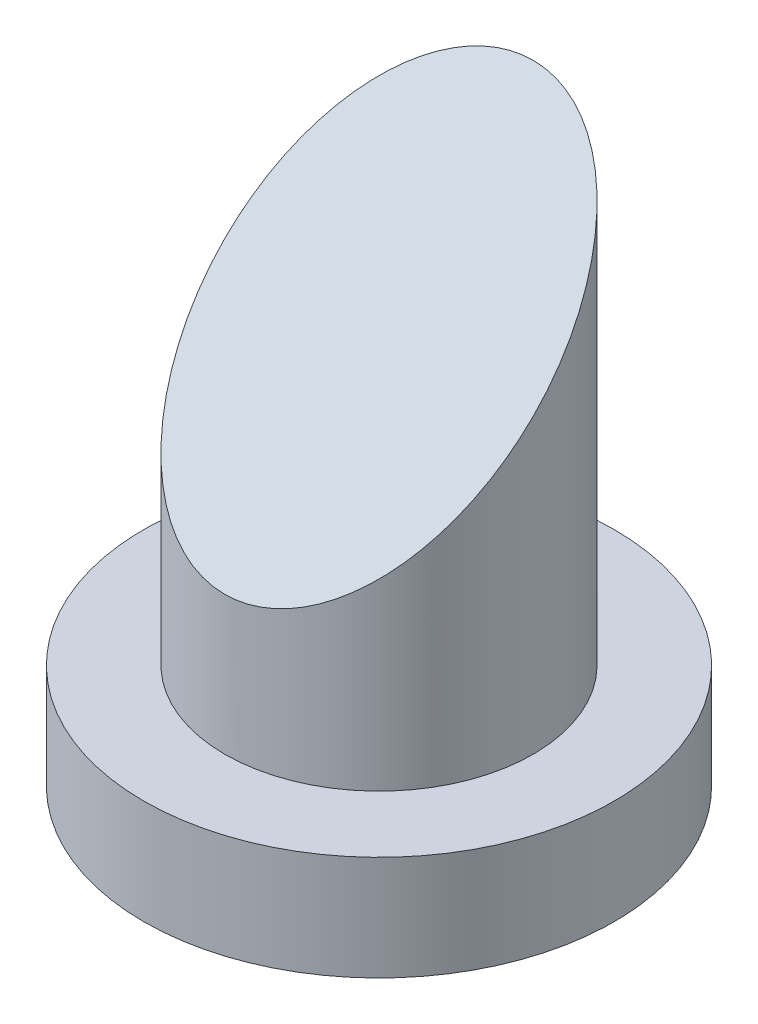
from build123d import *

# Parameters (mm, degrees)
SKETCH1_R               = 9
BOSS_EXTRUDE1_DEPTH     = 4
SKETCH2_R               = 5.9
BOSS_EXTRUDE2_DEPTH     = 20
CUT_EXTRUDE1_DEPTH      = 28.166155414
CUT_EXTRUDE1_DEPTH_BACK = 28.166155414
SKETCH4_R               = 0.425
CUT_EXTRUDE2_DEPTH      = 1.5


with BuildPart() as part:
    # Sketch1 → Boss-Extrude1 (new body)
    with BuildSketch(Plane(origin=(0, 0, 0), x_dir=(1, 0, 0), z_dir=(0, 1, 0))):
        with Locations(Location((0, 0, 0), (0, 0, 270))):
            Circle(SKETCH1_R)
    extrude(amount=BOSS_EXTRUDE1_DEPTH)

    # Sketch2 → Boss-Extrude2 (add)
    with BuildSketch(Plane(origin=(0, 4, 0), x_dir=(1, 0, 0), z_dir=(0, 1, 0))):
        with Locations(Location((0, 0, 0), (0, 0, 270))):
            Circle(SKETCH2_R)
    extrude(amount=BOSS_EXTRUDE2_DEPTH)

    # Sketch3 → Cut-Extrude1 (cut, two sides: drawn at the far end of the back side and taken through both)
    with BuildSketch(Plane(origin=(0, 0, 0), x_dir=(0, 0, -1), z_dir=(1, 0, 0)).offset(-CUT_EXTRUDE1_DEPTH_BACK)):
        Polygon((-6.28, 8.92), (6.28, 21.48), (6.28, 28.771900514), (-6.28, 28.771900514), align=None)
    extrude(amount=CUT_EXTRUDE1_DEPTH + CUT_EXTRUDE1_DEPTH_BACK, mode=Mode.SUBTRACT)

    # Sketch4 → Cut-Extrude2 (cut)
    with BuildSketch(Plane.XZ):
        with Locations(Location((0, -6, 0), (0, 0, 270))):
            Circle(SKETCH4_R)
    extrude(amount=-CUT_EXTRUDE2_DEPTH, mode=Mode.SUBTRACT)


solid = part.part
